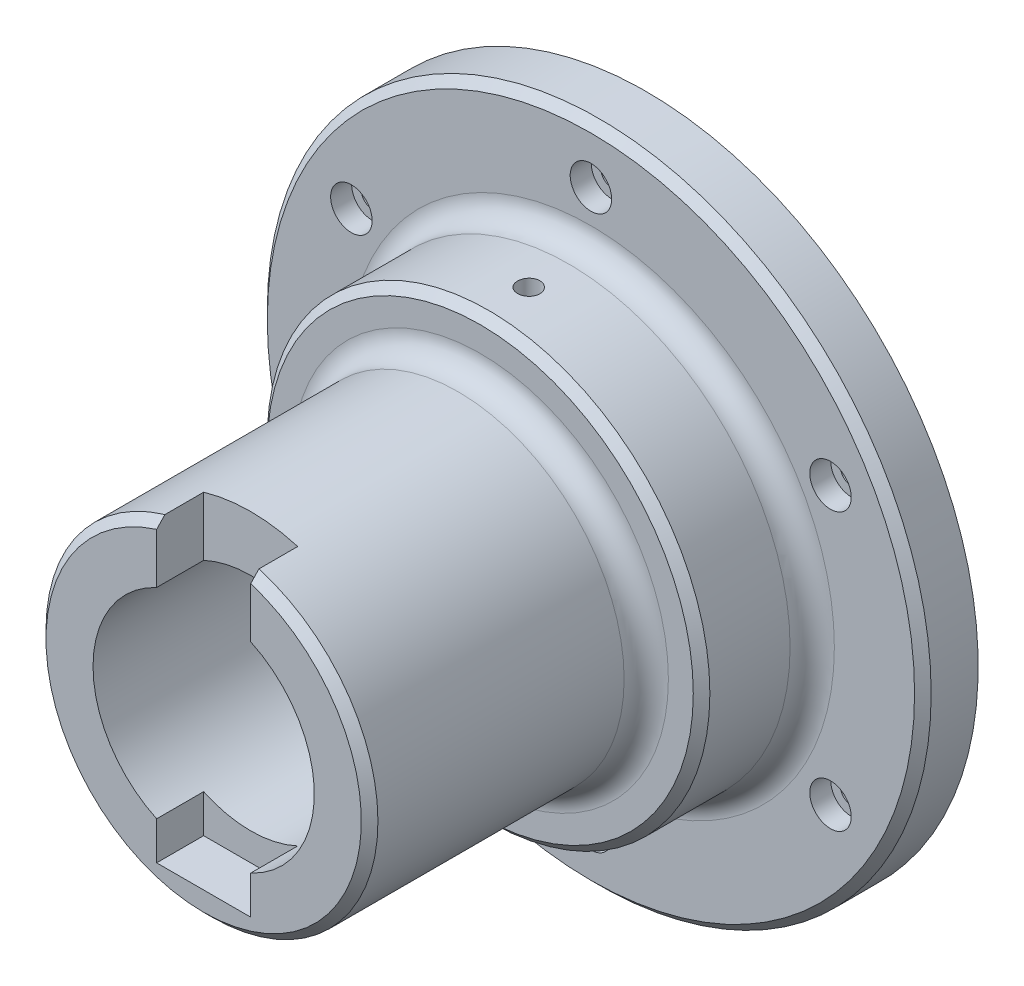
from build123d import *

# Parameters (mm, degrees)
FRONT_FILLET_R               = 5.08
FRONT_CHAMFER_SIZE           = 1.905
BLOCK_SKETCH_W               = 21.59
BLOCK_SKETCH_H               = 93.159413511
BLOCK_CUT_DEPTH              = 13.335
CIRCULAR_SKETCH_R            = 2.5527
CIRCULAR_CUT_DEPTH           = 140.7
CIRCULAR_PATTERN_COUNT       = 6
OUTER_CIRCULAR_SKETCH_R      = 4.7625
OUTER_CIRCULAR_CUT_DEPTH     = 4.826
OUTER_CIRCULAR_PATTERN_COUNT = 6
F_1_4_20_TOPMOST_CUT_REACH   = 167.839
F_1_4_20_TOPMOST_CUT_BORE_R  = 2.5527


with BuildPart() as part:
    # Base Sketch → Base Revolve (revolve)
    with BuildSketch(Plane(origin=(0, 0, 0), x_dir=(0, 0, -1), z_dir=(1, 0, 0)), mode=Mode.PRIVATE) as base_revolve_sk:
        Polygon((0, 76.2), (-12.7, 76.2), (-12.7, 50.8), (-38.1, 50.8), (-38.1, 38.1), (-101.6, 38.1), (-101.6, 25.4), (-31.75, 25.4), (-31.75, 28.575), (-19.05, 28.575), (-19.05, 25.4), (0, 25.4), align=None)
    revolve(base_revolve_sk.sketch.rotate(Axis((0, 0, 0), (0, 0, 1)), 90), axis=Axis((0, 0, 0), (0, 0, 1)))

    # Front Fillet
    front_fillet_edges = [part.edges().sort_by_distance(p)[0] for p in [
        (38.1, 0, 38.1),
        (50.8, 0, 12.7),
    ]]
    fillet(front_fillet_edges, radius=FRONT_FILLET_R)

    # Front Chamfer
    front_chamfer_edges = [part.edges().sort_by_distance(p)[0] for p in [
        (38.1, 0, 101.6),
        (50.8, 0, 38.1),
        (76.2, 0, 12.7),
    ]]
    chamfer(front_chamfer_edges, length=FRONT_CHAMFER_SIZE)

    # Block Sketch → Block Cut (cut)
    with BuildSketch(Plane.XY.offset(104.14)):
        with Locations((0, 14.829706756)):
            Rectangle(BLOCK_SKETCH_W, BLOCK_SKETCH_H)
    extrude(amount=-BLOCK_CUT_DEPTH, mode=Mode.SUBTRACT)

    # Circular Sketch → Circular Cut (cut, through all)
    with BuildSketch(Plane.XY.offset(12.7)):
        with Locations((0, 63.5)):
            Circle(CIRCULAR_SKETCH_R)
    circular_cut = extrude(amount=-CIRCULAR_CUT_DEPTH, mode=Mode.SUBTRACT)

    # Circular Pattern: Circular Cut ×6 about axis
    circular_pattern_axis = Axis((0, 0, 0), (0, 0, 1))
    for i in range(1, CIRCULAR_PATTERN_COUNT):
        add(circular_cut.rotate(circular_pattern_axis, i * 360 / CIRCULAR_PATTERN_COUNT), mode=Mode.SUBTRACT)

    # Outer Circular Sketch → Outer Circular Cut (cut)
    with BuildSketch(Plane.XY.offset(12.7)):
        with Locations((0, 63.5)):
            Circle(OUTER_CIRCULAR_SKETCH_R)
    outer_circular_cut = extrude(amount=-OUTER_CIRCULAR_CUT_DEPTH, mode=Mode.SUBTRACT)

    # Outer Circular Pattern: Outer Circular Cut ×6 about axis
    outer_circular_pattern_axis = Axis((0, 0, 0), (0, 0, 1))
    for i in range(1, OUTER_CIRCULAR_PATTERN_COUNT):
        add(outer_circular_cut.rotate(outer_circular_pattern_axis, i * 360 / OUTER_CIRCULAR_PATTERN_COUNT), mode=Mode.SUBTRACT)

    # 1/4-20 Topmost Cut bore (on position points) → 1/4-20 Topmost Cut (cut, up to next)
    with BuildSketch(Plane(origin=(0, 50.8, 26.9875), x_dir=(1, 0, 0), z_dir=(0, 1, 0)), mode=Mode.PRIVATE) as f_1_4_20_topmost_cut_sk1:
        Circle(F_1_4_20_TOPMOST_CUT_BORE_R)
    f_1_4_20_topmost_cut_tool1 = extrude(f_1_4_20_topmost_cut_sk1.sketch, amount=-F_1_4_20_TOPMOST_CUT_REACH, mode=Mode.PRIVATE) & part.part
    add(f_1_4_20_topmost_cut_tool1.solids().sort_by_distance((0, 50.8, 26.9875))[0], mode=Mode.SUBTRACT)


solid = part.part
